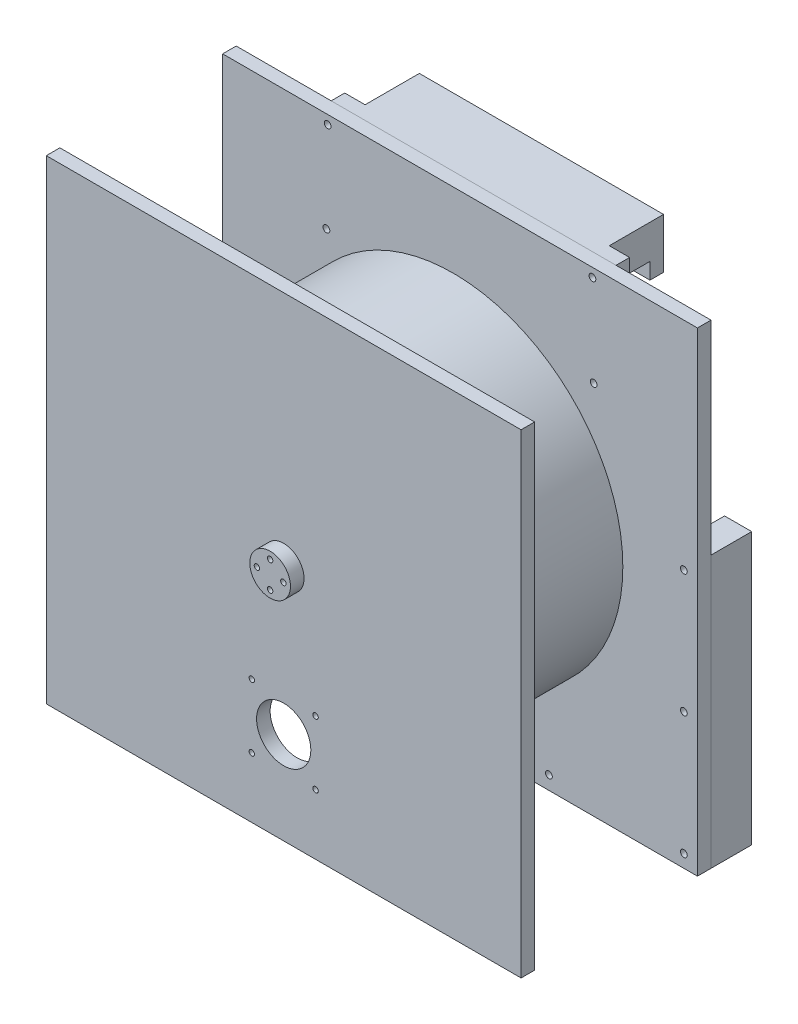
from build123d import *

# Parameters (mm, degrees)
BOSS_EXTRUDE1_START = 60
SKETCH1_W           = 350
SKETCH1_H           = 350
BOSS_EXTRUDE1_DEPTH = 10
BOSS_EXTRUDE2_START = -60
SKETCH1_2_W         = 350
SKETCH1_2_H         = 350
BOSS_EXTRUDE2_DEPTH = 10
BOSS_EXTRUDE3_DEPTH = 90
BOSS_EXTRUDE4_DEPTH = 105
SKETCH4_R           = 2.5
CUT_EXTRUDE1_DEPTH  = 10
SKETCH4_4_W         = 20
SKETCH4_4_H         = 200
SKETCH4_4_R         = 2.5
BOSS_EXTRUDE5_DEPTH = 30
SKETCH5_R           = 4
CUT_EXTRUDE2_DEPTH  = 7
SKETCH6_R           = 4.5
CUT_EXTRUDE3_DEPTH  = 285.341344162
SKETCH6_3_R         = 2
CUT_EXTRUDE4_DEPTH  = 10
SKETCH6_4_R         = 15
SKETCH6_4_R_2       = 4.5
SKETCH6_4_R_3       = 2
BOSS_EXTRUDE6_DEPTH = 5
BOSS_EXTRUDE7_START = 5
SKETCH6_5_R         = 15
SKETCH6_5_R_2       = 2
BOSS_EXTRUDE7_DEPTH = 5
SKETCH7_R           = 2.5
CUT_EXTRUDE5_DEPTH  = 10
SKETCH7_3_W         = 150
SKETCH7_3_H         = 20
SKETCH7_3_R         = 2.5
BOSS_EXTRUDE8_DEPTH = 10
CUT_EXTRUDE6_START  = 70
SKETCH8_R           = 2
SKETCH8_R_2         = 20
CUT_EXTRUDE6_DEPTH  = 125
CUT_EXTRUDE7_START  = -20
SKETCH9_R           = 2.5
CUT_EXTRUDE7_DEPTH  = 20


with BuildPart() as part:
    # Sketch1 → Boss-Extrude1 (new body)
    with BuildSketch(Plane.XY.offset(BOSS_EXTRUDE1_START)):
        Rectangle(SKETCH1_W, SKETCH1_H)
    extrude(amount=BOSS_EXTRUDE1_DEPTH)


with BuildPart() as body_2:
    # Sketch1<2> → Boss-Extrude2 (new body)
    with BuildSketch(Plane.XY.offset(BOSS_EXTRUDE2_START)):
        Rectangle(SKETCH1_2_W, SKETCH1_2_H)
    extrude(amount=-BOSS_EXTRUDE2_DEPTH)

    # Sketch4 → Cut-Extrude1 (cut)
    with BuildSketch(Plane(origin=(0, 0, -70), x_dir=(-1, 0, 0), z_dir=(0, 0, -1))):
        with Locations((-165, 15.5)):
            Circle(SKETCH4_R)
        with Locations((-165, -165.5)):
            Circle(SKETCH4_R)
        with Locations((-165, -75)):
            Circle(SKETCH4_R)
    extrude(amount=-CUT_EXTRUDE1_DEPTH, mode=Mode.SUBTRACT)


with BuildPart() as body_3:
    # Sketch2 → Revolve1 (revolve)
    with BuildSketch(Plane(origin=(0, 0, 0), x_dir=(1, 0, 0), z_dir=(0, 1, 0)), mode=Mode.PRIVATE) as revolve1_sk:
        Polygon((-125, 55), (-125, -35), (-82, -35), (-82, -55), (-10, -55), (-10, 55), align=None)
    revolve(revolve1_sk.sketch.rotate(Axis((0, 0, 59.553807794), (0, 0, -1)), 180), axis=Axis((0, 0, 59.553807794), (0, 0, -1)))


with BuildPart() as body_4:
    # Sketch3 → Boss-Extrude3 (new, symmetric)
    with BuildSketch(Plane(origin=(0, 0, 0), x_dir=(0, 0, -1), z_dir=(1, 0, 0))):
        Polygon((70, 95), (70, 175), (120, 175), (120, 175.084303096), (120, 138), (110, 138), (110, 150), (80, 150), (80, 95), align=None)
    extrude(amount=BOSS_EXTRUDE3_DEPTH, both=True)

    # Sketch3<3> → Boss-Extrude4 (add, symmetric)
    with BuildSketch(Plane(origin=(0, 0, 0), x_dir=(0, 0, -1), z_dir=(1, 0, 0))):
        Polygon((70, 175), (70, 95), (80, 95), (80, 150), (80, 175), align=None)
    extrude(amount=BOSS_EXTRUDE4_DEPTH, both=True)


with BuildPart() as body_5:
    # Sketch4<4> → Boss-Extrude5 (new body)
    with BuildSketch(Plane(origin=(0, 0, -70), x_dir=(-1, 0, 0), z_dir=(0, 0, -1))):
        with Locations((-165, -75)):
            Rectangle(SKETCH4_4_W, SKETCH4_4_H)
        with Locations((-165, 15.5)):
            Circle(SKETCH4_4_R, mode=Mode.SUBTRACT)
        with Locations((-165, -165.5)):
            Circle(SKETCH4_4_R, mode=Mode.SUBTRACT)
        with Locations((-165, -75)):
            Circle(SKETCH4_4_R, mode=Mode.SUBTRACT)
    extrude(amount=BOSS_EXTRUDE5_DEPTH)

    # Sketch5 → Cut-Extrude2 (cut)
    with BuildSketch(Plane.XY.offset(-70)):
        with Locations((165, 15.5)):
            Circle(SKETCH5_R)
        with Locations((165, -75)):
            Circle(SKETCH5_R)
        with Locations((165, -165.5)):
            Circle(SKETCH5_R)
    extrude(amount=-CUT_EXTRUDE2_DEPTH, mode=Mode.SUBTRACT)


with BuildPart() as body_6:
    # Mirror4: mirrored copy
    add(body_5.part.mirror(Plane(origin=(0, 0, 0), x_dir=(0, 0, 1), z_dir=(1, 0, 0))))


with BuildPart() as cut_extrude3_tool:
    # Sketch6 → Cut-Extrude3 (new, through all)
    with BuildSketch(Plane(origin=(0, 0, -70), x_dir=(-1, 0, 0), z_dir=(0, 0, -1))):
        Circle(SKETCH6_R)
    extrude(amount=-CUT_EXTRUDE3_DEPTH)


with BuildPart() as part_1:
    add(part.part)

    # Cut-Extrude3: cut by cut_extrude3_tool
    add(cut_extrude3_tool.part, mode=Mode.SUBTRACT)


with BuildPart() as body_2_1:
    add(body_2.part)

    # Cut-Extrude3: cut by cut_extrude3_tool
    add(cut_extrude3_tool.part, mode=Mode.SUBTRACT)

    # Sketch6<3> → Cut-Extrude4 (cut)
    with BuildSketch(Plane(origin=(0, 0, -70), x_dir=(-1, 0, 0), z_dir=(0, 0, -1))):
        with Locations((0, 9.75)):
            Circle(SKETCH6_3_R)
        with Locations((9.75, 0)):
            Circle(SKETCH6_3_R)
        with Locations((0, -9.75)):
            Circle(SKETCH6_3_R)
        with Locations((-9.75, 0)):
            Circle(SKETCH6_3_R)
    cut_extrude4 = extrude(amount=-CUT_EXTRUDE4_DEPTH, mode=Mode.SUBTRACT)

    # Sketch7 → Cut-Extrude5 (cut)
    with BuildSketch(Plane(origin=(0, 0, -70), x_dir=(-1, 0, 0), z_dir=(0, 0, -1))):
        with Locations((-65.5, -165)):
            Circle(SKETCH7_R)
        with Locations((65.5, -165)):
            Circle(SKETCH7_R)
        with Locations((0, -165)):
            Circle(SKETCH7_R)
    extrude(amount=-CUT_EXTRUDE5_DEPTH, mode=Mode.SUBTRACT)


with BuildPart() as body_7:
    # Sketch6<4> → Boss-Extrude6 (new body)
    with BuildSketch(Plane(origin=(0, 0, -70), x_dir=(-1, 0, 0), z_dir=(0, 0, -1))):
        Circle(SKETCH6_4_R)
        Circle(SKETCH6_4_R_2, mode=Mode.SUBTRACT)
        with Locations((0, 9.75)):
            Circle(SKETCH6_4_R_3, mode=Mode.SUBTRACT)
        with Locations((9.75, 0)):
            Circle(SKETCH6_4_R_3, mode=Mode.SUBTRACT)
        with Locations((0, -9.75)):
            Circle(SKETCH6_4_R_3, mode=Mode.SUBTRACT)
        with Locations((-9.75, 0)):
            Circle(SKETCH6_4_R_3, mode=Mode.SUBTRACT)
    extrude(amount=BOSS_EXTRUDE6_DEPTH)

    # Sketch6<5> → Boss-Extrude7 (add)
    with BuildSketch(Plane(origin=(0, 0, -70), x_dir=(-1, 0, 0), z_dir=(0, 0, -1)).offset(BOSS_EXTRUDE7_START)):
        Circle(SKETCH6_5_R)
        with Locations((0, 9.75)):
            Circle(SKETCH6_5_R_2, mode=Mode.SUBTRACT)
        with Locations((9.75, 0)):
            Circle(SKETCH6_5_R_2, mode=Mode.SUBTRACT)
        with Locations((0, -9.75)):
            Circle(SKETCH6_5_R_2, mode=Mode.SUBTRACT)
        with Locations((-9.75, 0)):
            Circle(SKETCH6_5_R_2, mode=Mode.SUBTRACT)
    extrude(amount=BOSS_EXTRUDE7_DEPTH)


with BuildPart() as part_2:
    add(part_1.part)

    # Mirror2: Cut-Extrude4 across plane
    add(cut_extrude4.mirror(Plane.XY), mode=Mode.SUBTRACT)

    # Sketch8 → Cut-Extrude6 (cut)
    with BuildSketch(Plane.XY.offset(CUT_EXTRUDE6_START)):
        with Locations((-23.5, -83.5)):
            Circle(SKETCH8_R)
        with Locations((23.5, -83.5)):
            Circle(SKETCH8_R)
        with Locations((-23.5, -130.5)):
            Circle(SKETCH8_R)
        with Locations((23.5, -130.5)):
            Circle(SKETCH8_R)
        with Locations((0, -107)):
            Circle(SKETCH8_R_2)
    extrude(amount=-CUT_EXTRUDE6_DEPTH, mode=Mode.SUBTRACT)


with BuildPart() as body_8:
    # Mirror3: mirrored copy
    add(body_7.part.mirror(Plane.XY))


with BuildPart() as body_9:
    # Sketch7<3> → Boss-Extrude8 (new body)
    with BuildSketch(Plane(origin=(0, 0, -70), x_dir=(-1, 0, 0), z_dir=(0, 0, -1))):
        with Locations((0, -165)):
            Rectangle(SKETCH7_3_W, SKETCH7_3_H)
        with Locations((-65.5, -165)):
            Circle(SKETCH7_3_R, mode=Mode.SUBTRACT)
        with Locations((65.5, -165)):
            Circle(SKETCH7_3_R, mode=Mode.SUBTRACT)
        with Locations((0, -165)):
            Circle(SKETCH7_3_R, mode=Mode.SUBTRACT)
    extrude(amount=BOSS_EXTRUDE8_DEPTH)


with BuildPart() as cut_extrude7_tool:
    # Sketch9 → Cut-Extrude7 (new body)
    with BuildSketch(Plane(origin=(0, 0, -80), x_dir=(-1, 0, 0), z_dir=(0, 0, -1)).offset(CUT_EXTRUDE7_START)):
        with Locations(Location((-97.588435374, 168.5, 0), (0, 0, 90))):
            Circle(SKETCH9_R)
        with Locations(Location((-98.5, 101.5, 0), (0, 0, 90))):
            Circle(SKETCH9_R)
        with Locations(Location((0, 101.5, 0), (0, 0, 90))):
            Circle(SKETCH9_R)
        with Locations(Location((97.588435374, 168.5, 0), (0, 0, 180))):
            Circle(SKETCH9_R)
        with Locations(Location((98.5, 101.5, 0), (0, 0, 180))):
            Circle(SKETCH9_R)
    extrude(amount=CUT_EXTRUDE7_DEPTH)


with BuildPart() as body_2_2:
    add(body_2_1.part)

    # Cut-Extrude7: cut by cut_extrude7_tool
    add(cut_extrude7_tool.part, mode=Mode.SUBTRACT)


with BuildPart() as body_4_1:
    add(body_4.part)

    # Cut-Extrude7: cut by cut_extrude7_tool
    add(cut_extrude7_tool.part, mode=Mode.SUBTRACT)


solid = Compound([body_3.part, body_5.part, body_6.part, body_7.part, part_2.part, body_8.part, body_9.part, body_2_2.part, body_4_1.part])
